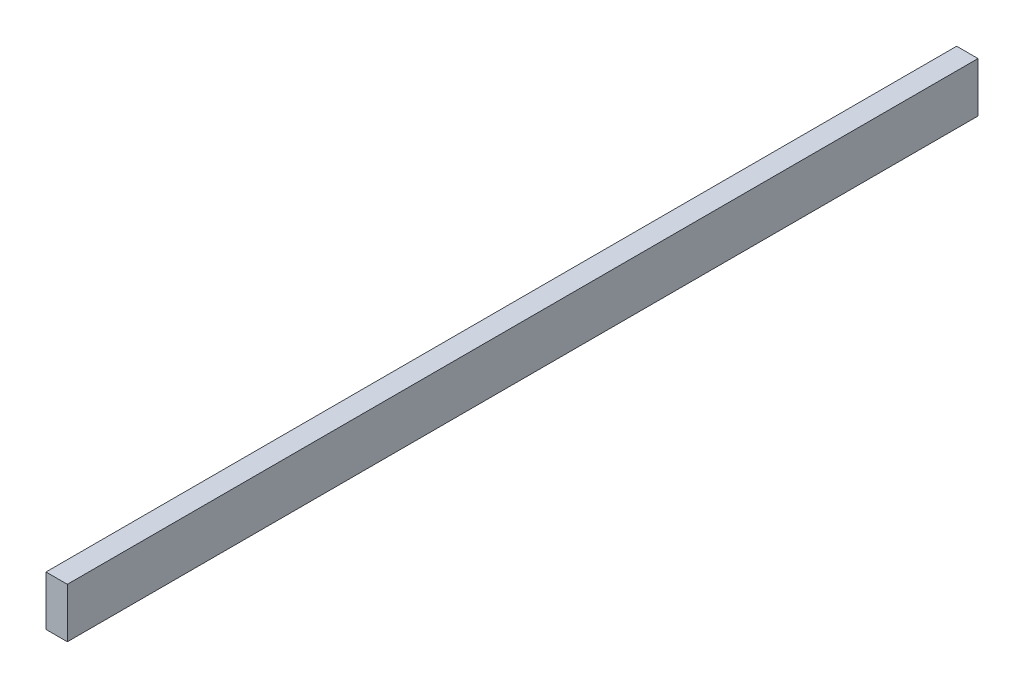
from build123d import *

# Parameters (mm, degrees)
SKETCH1_W           = 1625.6
SKETCH1_H           = 88.9
BOSS_EXTRUDE1_DEPTH = 38.1


with BuildPart() as part:
    # Sketch1 → Boss-Extrude1 (new body)
    with BuildSketch(Plane(origin=(0, 0, 0), x_dir=(0, 0, -1), z_dir=(1, 0, 0))):
        Rectangle(SKETCH1_W, SKETCH1_H)
    extrude(amount=BOSS_EXTRUDE1_DEPTH)


solid = part.part
